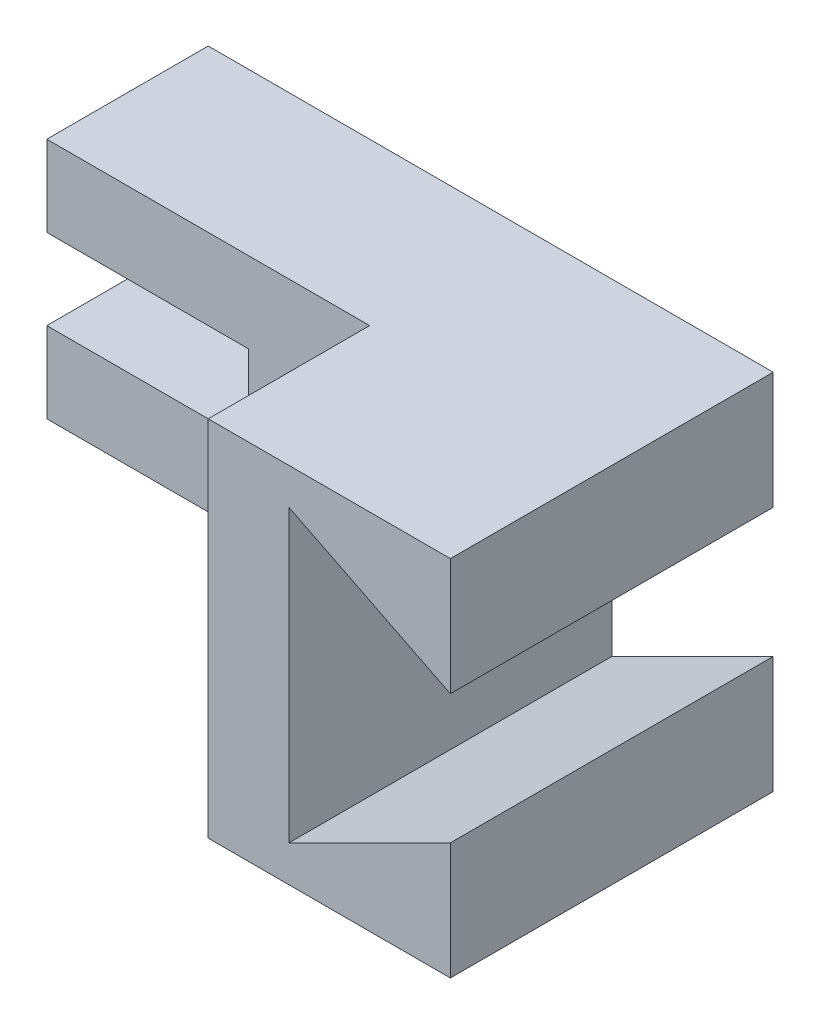
from build123d import *

# Parameters (mm, degrees)
AUFSATZ_LINEAR_AUSTRAGEN1_DEPTH      = 20
SKIZZE2_W                            = 40
SKIZZE2_H                            = 45
AUFSATZ_LINEAR_AUSTRAGEN3_DEPTH      = 30
SCHNITT_LINEAR_AUSTRAGEN1_DEPTH      = 87.02325267
SCHNITT_LINEAR_AUSTRAGEN1_DEPTH_BACK = 40


with BuildPart() as part:
    # Skizze1 → Aufsatz-Linear austragen1 (new body)
    with BuildSketch(Plane.XY):
        Polygon((0, 0), (40, 0), (40, 30), (0, 30), (0, 20), (25, 20), (25, 10), (0, 10), align=None)
    extrude(amount=AUFSATZ_LINEAR_AUSTRAGEN1_DEPTH)

    # Skizze2 → Aufsatz-Linear austragen3 (add)
    with BuildSketch(Plane(origin=(40, 0, 0), x_dir=(0, 0, -1), z_dir=(1, 0, 0))):
        with Locations((-20, 7.5)):
            Rectangle(SKIZZE2_W, SKIZZE2_H)
    extrude(amount=AUFSATZ_LINEAR_AUSTRAGEN3_DEPTH)

    # Skizze3 → Schnitt-Linear austragen1 (cut, two sides: drawn at the far end of the back side and taken through both)
    with BuildSketch(Plane.XY.offset(40).offset(-SCHNITT_LINEAR_AUSTRAGEN1_DEPTH_BACK)):
        Polygon((215.534169047, -57.267084524), (70, 15.5), (50, 25.5), (50, -10.5), (70, -0.5), (215.534169047, 72.267084524), (-109.890125992, 72.267084524), (-109.890125992, -57.267084524), align=None)
    extrude(amount=SCHNITT_LINEAR_AUSTRAGEN1_DEPTH + SCHNITT_LINEAR_AUSTRAGEN1_DEPTH_BACK, mode=Mode.SUBTRACT)


solid = part.part
